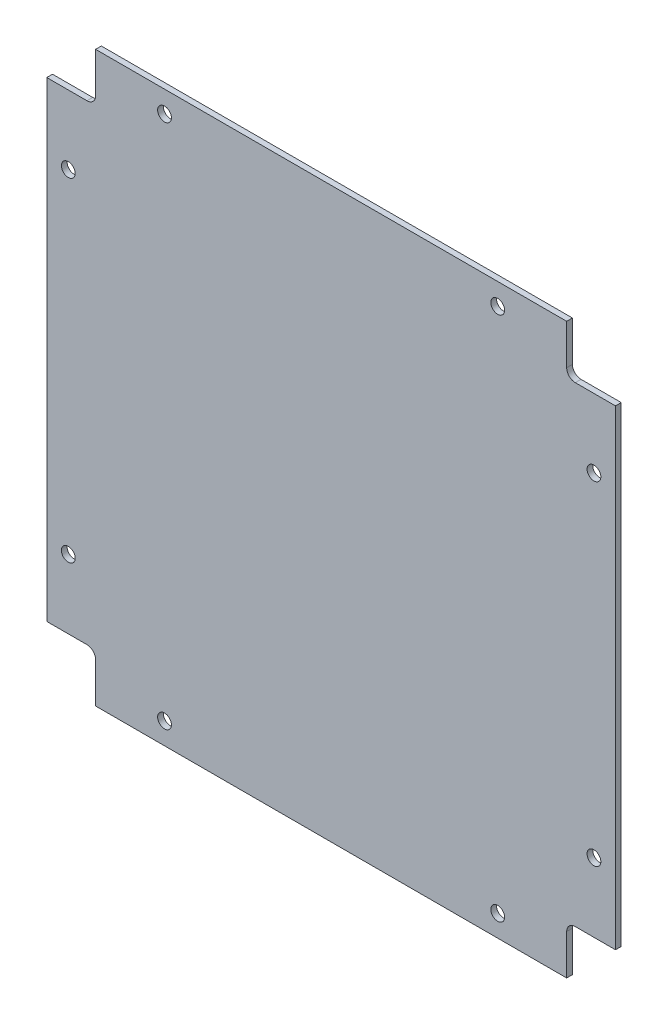
from build123d import *

# Parameters (mm, degrees)
SKETCH1_W           = 99
SKETCH1_H           = 99
BOSS_EXTRUDE1_DEPTH = 0.5
CUT_EXTRUDE1_DEPTH  = 71.010713466
M2_HOLE1_B_D        = 2.4
M2_HOLE1_B_DEPTH    = 3
M2_HOLE1_B_TIP      = 0.721032743


with BuildPart() as part:
    # Sketch1 → Boss-Extrude1 (new, symmetric)
    with BuildSketch(Plane.XY):
        Rectangle(SKETCH1_W, SKETCH1_H)
    extrude(amount=BOSS_EXTRUDE1_DEPTH, both=True)

    # Sketch2 → Cut-Extrude1 (cut, through all)
    with BuildSketch(Plane.XY.offset(0.5)):
        with BuildLine():
            Line((-49.5, 49.5), (-41, 49.5))
            Line((-41, 49.5), (-41, 42.5))
            ThreePointArc((-41, 42.5), (-41.439339828, 41.439339828), (-42.5, 41))
            Line((-42.5, 41), (-49.5, 41))
            Line((-49.5, 41), (-49.5, 49.5))
        make_face()
        with BuildLine():
            Line((49.5, 49.5), (41, 49.5))
            Line((41, 49.5), (41, 42.5))
            ThreePointArc((41, 42.5), (41.439339828, 41.439339828), (42.5, 41))
            Line((42.5, 41), (49.5, 41))
            Line((49.5, 41), (49.5, 49.5))
        make_face()
        with BuildLine():
            Line((-49.5, -49.5), (-41, -49.5))
            Line((-41, -49.5), (-41, -42.5))
            ThreePointArc((-41, -42.5), (-41.439339828, -41.439339828), (-42.5, -41))
            Line((-42.5, -41), (-49.5, -41))
            Line((-49.5, -41), (-49.5, -49.5))
        make_face()
        with BuildLine():
            Line((49.5, -49.5), (41, -49.5))
            Line((41, -49.5), (41, -42.5))
            ThreePointArc((41, -42.5), (41.439339828, -41.439339828), (42.5, -41))
            Line((42.5, -41), (49.5, -41))
            Line((49.5, -41), (49.5, -49.5))
        make_face()
    extrude(amount=-CUT_EXTRUDE1_DEPTH, mode=Mode.SUBTRACT)

    # M2 Hole1 - B
    with Locations(Plane.XY.offset(0.5)):
        with Locations((-45.75, 29), (-29, 45.75), (29, 45.75), (45.75, 29), (45.75, -29), (29, -45.75), (-29, -45.75), (-45.75, -29)):
            Hole(M2_HOLE1_B_D / 2, depth=M2_HOLE1_B_DEPTH)
            with Locations((0, 0, -(M2_HOLE1_B_DEPTH + M2_HOLE1_B_TIP / 2))):  # 118° drill point
                Cone(0, M2_HOLE1_B_D / 2, M2_HOLE1_B_TIP, mode=Mode.SUBTRACT)


solid = part.part
